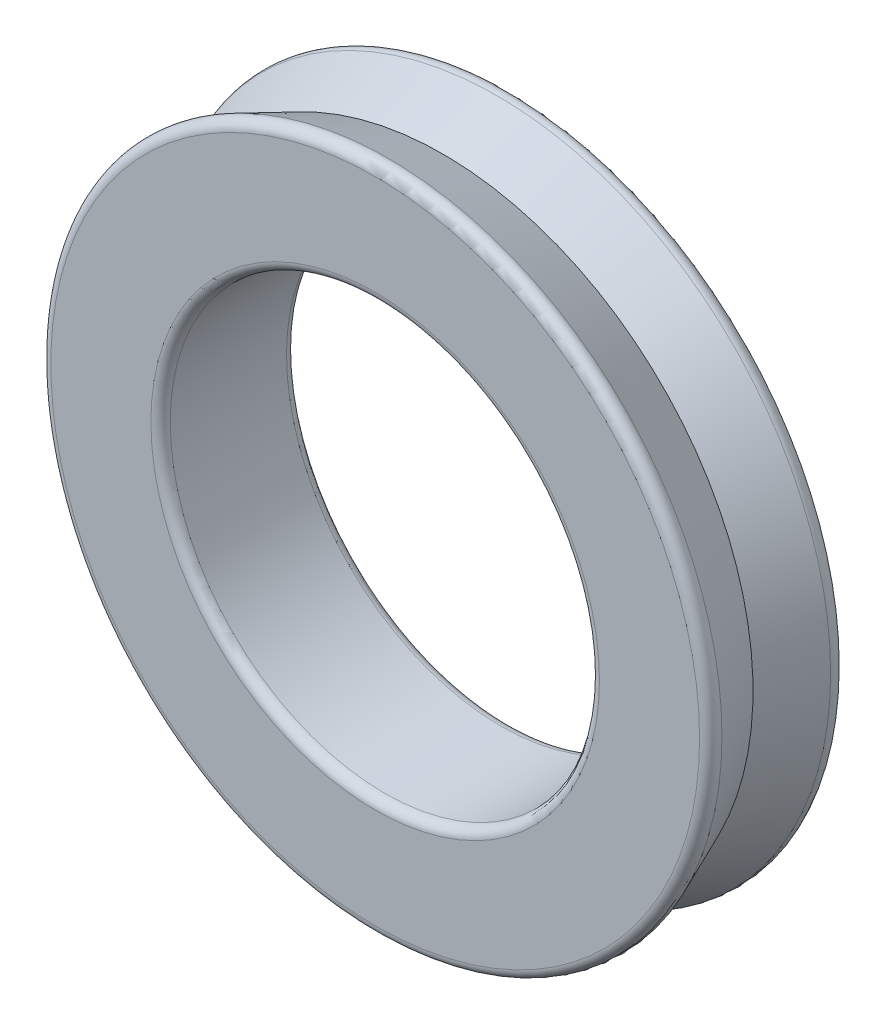
from build123d import *

# Parameters (mm, degrees)
SKETCH1_R           = 17.5
SKETCH1_R_2         = 11.075
BOSS_EXTRUDE1_DEPTH = 7
FILLET1_R           = 0.5
FILLET2_R           = 0.5


with BuildPart() as part:
    # Sketch1 → Boss-Extrude1 (new body)
    with BuildSketch(Plane.XY):
        Circle(SKETCH1_R)
        Circle(SKETCH1_R_2, mode=Mode.SUBTRACT)
    extrude(amount=BOSS_EXTRUDE1_DEPTH)

    # Sketch2 → Cut-Revolve1 (revolve, cut)
    with BuildSketch(Plane(origin=(0, 0, 0), x_dir=(1, 0, 0), z_dir=(0, 1, 0)), mode=Mode.PRIVATE) as cut_revolve1_sk:
        Polygon((17.5, 0), (16, -3.5), (17.5, -7), align=None)
    revolve(cut_revolve1_sk.sketch.rotate(Axis((0, 0, 0), (0, 0, 1)), 180), axis=Axis((0, 0, 0), (0, 0, 1)), mode=Mode.SUBTRACT)

    # Fillet1
    fillet1_edges = [part.edges().sort_by_distance(p)[0] for p in [
        (17.5, 0, 7),
        (17.5, 0, 0),
    ]]
    fillet(fillet1_edges, radius=FILLET1_R)

    # Fillet2
    fillet2_edges = [part.edges().sort_by_distance(p)[0] for p in [
        (-11.075, 0, 0),
        (-11.075, 0, 7),
    ]]
    fillet(fillet2_edges, radius=FILLET2_R)


solid = part.part
